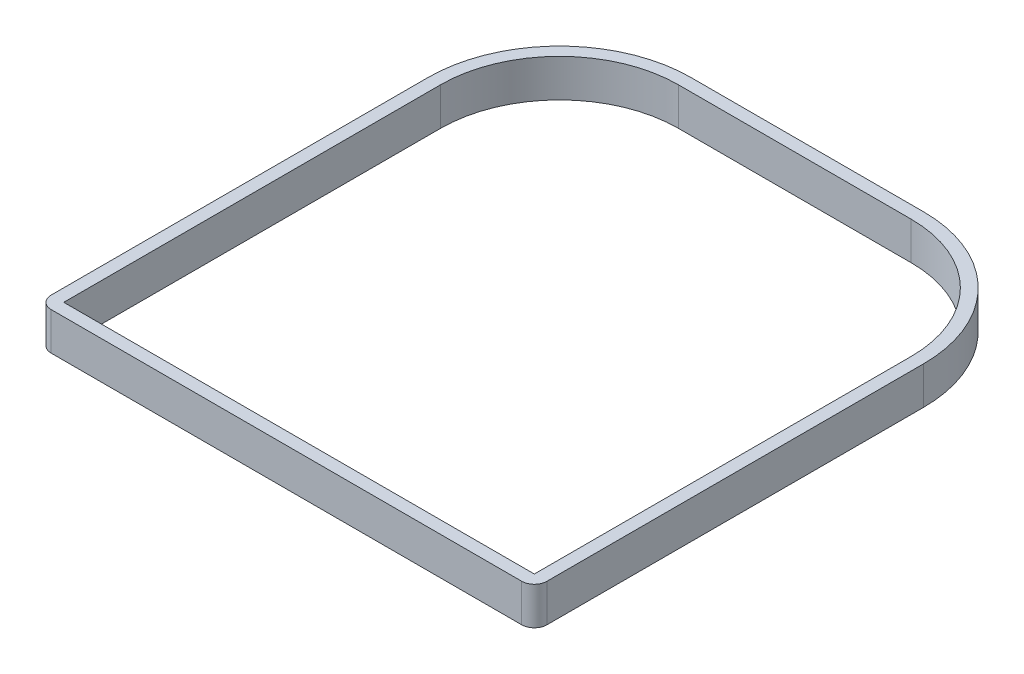
from build123d import *

# Parameters (mm, degrees)
BOSS_EXTRUDE1_DEPTH = 1.5
FILLET1_R           = 1


with BuildPart() as part:
    # Sketch1 → Boss-Extrude1 (new, symmetric)
    with BuildSketch(Plane(origin=(0, 0, 0), x_dir=(1, 0, 0), z_dir=(0, 1, 0))):
        with BuildLine():
            Line((-19.7, 9.25), (-19.7, -21.7))
            Line((-19.7, -21.7), (19.7, -21.7))
            Line((19.7, -21.7), (19.7, 9.25))
            ThreePointArc((19.7, 9.25), (16.639265863, 16.639265863), (9.25, 19.7))
            Line((9.25, 19.7), (-9.25, 19.7))
            ThreePointArc((-9.25, 19.7), (-16.639265863, 16.639265863), (-19.7, 9.25))
        make_face()
        with BuildLine():
            Line((-18.7, -20.7), (18.7, -20.7))
            Line((18.7, -20.7), (18.7, 9.25))
            ThreePointArc((18.7, 9.25), (15.932159082, 15.932159082), (9.25, 18.7))
            Line((9.25, 18.7), (-9.25, 18.7))
            ThreePointArc((-9.25, 18.7), (-15.932159082, 15.932159082), (-18.7, 9.25))
            Line((-18.7, 9.25), (-18.7, -20.7))
        make_face(mode=Mode.SUBTRACT)
    extrude(amount=BOSS_EXTRUDE1_DEPTH, both=True)

    # Fillet1
    fillet1_edges = [part.edges().sort_by_distance(p)[0] for p in [
        (19.7, 0, 21.7),
        (-19.7, 0, 21.7),
    ]]
    fillet(fillet1_edges, radius=FILLET1_R)


solid = part.part
